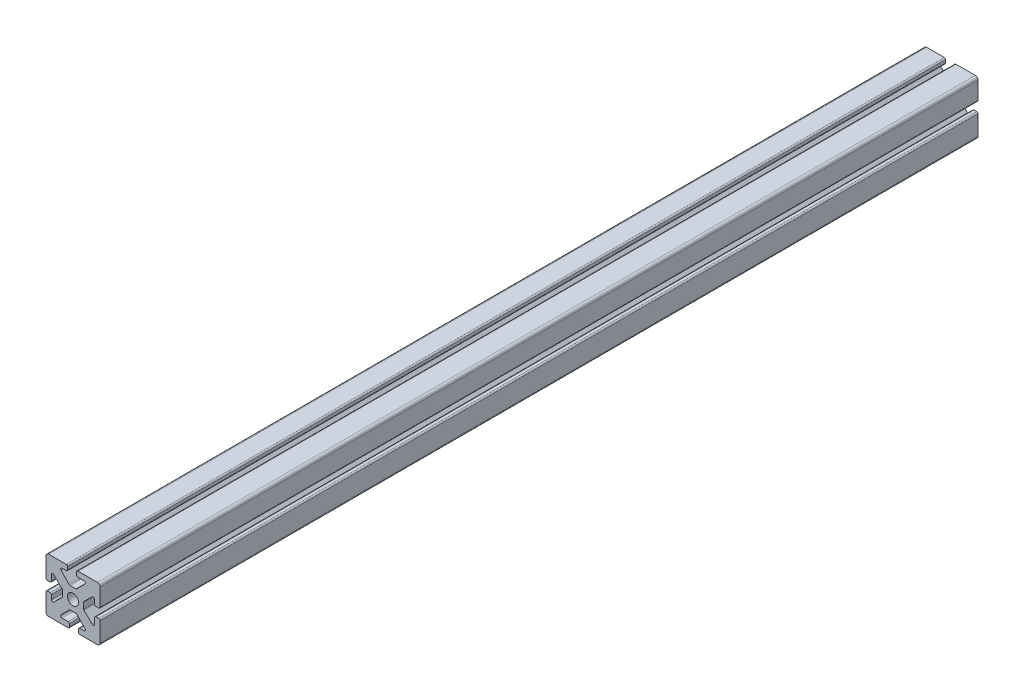
from build123d import *

# Parameters (mm, degrees)
SKETCH_1_W               = 40
SKETCH_1_H               = 40
EXTRUDE_1_DEPTH          = 650
SKETCH_2_R               = 4.05
CUT_EXTRUDE_1_DEPTH      = 10000
CUT_EXTRUDE_2_DEPTH      = 10000
FILLET_1_R               = 1
PATTERN_CIRCULAR_2_COUNT = 4
FILLET_2_R               = 1
FILLET_3_R               = 1
FILLET_4_R               = 1
FILLET_5_R               = 2


with BuildPart() as part:
    # 草图1 → 凸台-拉伸1 (new body)
    with BuildSketch(Plane.XY):
        Rectangle(SKETCH_1_W, SKETCH_1_H)
    extrude(amount=EXTRUDE_1_DEPTH)

    # 草图2 → 切除-拉伸1 (cut)
    with BuildSketch(Plane.XY.offset(650)):
        Circle(SKETCH_2_R)
    extrude(amount=-CUT_EXTRUDE_1_DEPTH, mode=Mode.SUBTRACT)

    # 草图4 → 切除-拉伸2 (cut)
    with BuildSketch(Plane.XY.offset(650)):
        Polygon((20, 0), (20, 4), (16, 4), (16, 10.5), (7.876860985, 2.6), (7.876860985, -2.6), (16, -10.5), (16, -2.65197969), (20, -2.65197969), align=None)
    cut_extrude_2 = extrude(amount=-CUT_EXTRUDE_2_DEPTH, mode=Mode.SUBTRACT)

    # 圆角1
    fillet_1_edges = [part.edges().sort_by_distance(p)[0] for p in [
        (20, -2.65197969, 325),
        (16, -2.65197969, 325),
        (16, -10.5, 325),
        (7.876860985, -2.6, 325),
        (7.876860985, 2.6, 325),
        (16, 10.5, 325),
        (16, 4, 325),
        (20, 4, 325),
    ]]
    fillet(fillet_1_edges, radius=FILLET_1_R)

    # 阵列(圆周)2: 切除-拉伸2 ×4 about axis
    pattern_circular_2_axis = Axis((0, 0, 0), (0, 0, 1))
    for i in range(1, PATTERN_CIRCULAR_2_COUNT):
        add(cut_extrude_2.rotate(pattern_circular_2_axis, i * 360 / PATTERN_CIRCULAR_2_COUNT), mode=Mode.SUBTRACT)

    # 圆角2
    fillet_2_edges = [part.edges().sort_by_distance(p)[0] for p in [
        (2.65197969, 20, 325),
        (2.65197969, 16, 325),
        (10.5, 16, 325),
        (2.6, 7.876860985, 325),
        (-2.6, 7.876860985, 325),
        (-10.5, 16, 325),
        (-4, 16, 325),
        (-4, 20, 325),
    ]]
    fillet(fillet_2_edges, radius=FILLET_2_R)

    # 圆角3
    fillet_3_edges = [part.edges().sort_by_distance(p)[0] for p in [
        (-20, 2.65197969, 325),
        (-16, 2.65197969, 325),
        (-16, 10.5, 325),
        (-7.876860985, 2.6, 325),
        (-7.876860985, -2.6, 325),
        (-16, -10.5, 325),
        (-16, -4, 325),
        (-20, -4, 325),
    ]]
    fillet(fillet_3_edges, radius=FILLET_3_R)

    # 圆角4
    fillet_4_edges = [part.edges().sort_by_distance(p)[0] for p in [
        (-2.65197969, -20, 325),
        (-2.65197969, -16, 325),
        (-10.5, -16, 325),
        (-2.6, -7.876860985, 325),
        (2.6, -7.876860985, 325),
        (10.5, -16, 325),
        (4, -16, 325),
        (4, -20, 325),
    ]]
    fillet(fillet_4_edges, radius=FILLET_4_R)

    # 圆角5
    fillet_5_edges = [part.edges().sort_by_distance(p)[0] for p in [
        (20, -20, 325),
        (-20, -20, 325),
        (-20, 20, 325),
        (20, 20, 325),
    ]]
    fillet(fillet_5_edges, radius=FILLET_5_R)


solid = part.part
